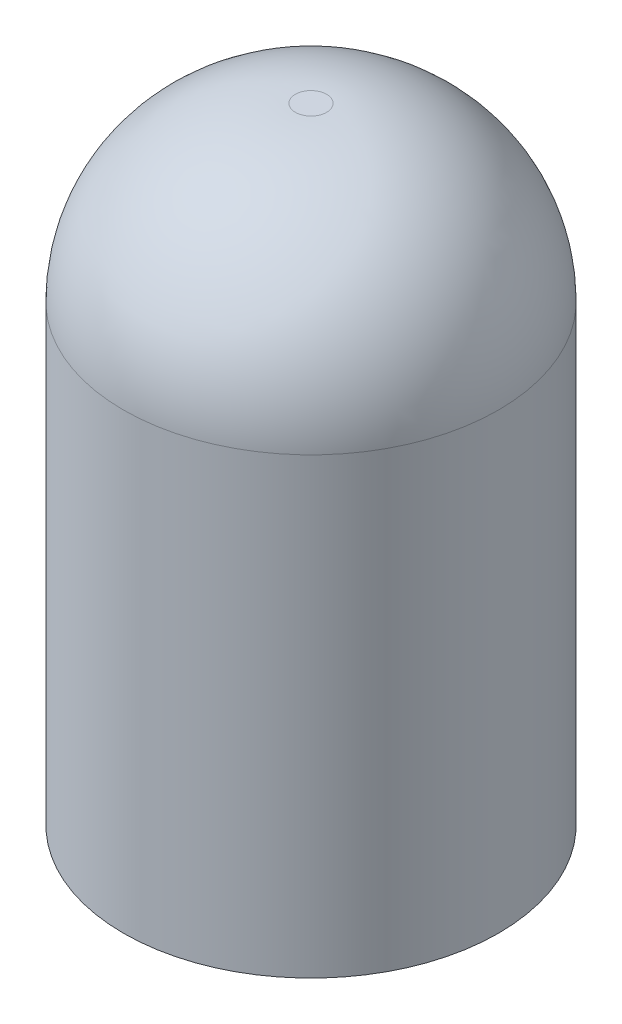
from build123d import *

# Parameters (mm, degrees)
SHELL1_T = -2


with BuildPart() as part:
    # Sketch1 → Revolve1 (revolve)
    with BuildSketch(Plane.XY, mode=Mode.PRIVATE) as revolve1_sk:
        with BuildLine():
            Line((0, 0), (60, 0))
            Line((60, 0), (60, 145))
            ThreePointArc((60, 145), (43.890872965, 183.890872965), (5, 200))
            Line((5, 200), (0, 200))
            Line((0, 200), (0, 0))
        make_face()
    revolve(revolve1_sk.sketch.rotate(Axis((0, 200, 0), (0, -1, 0)), 180), axis=Axis((0, 200, 0), (0, -1, 0)))

    # Shell1
    shell1_openings = [part.faces().sort_by_distance(p)[0] for p in [
        (0, 0, 0),
    ]]
    offset(amount=SHELL1_T, openings=shell1_openings, kind=Kind.INTERSECTION)


solid = part.part
